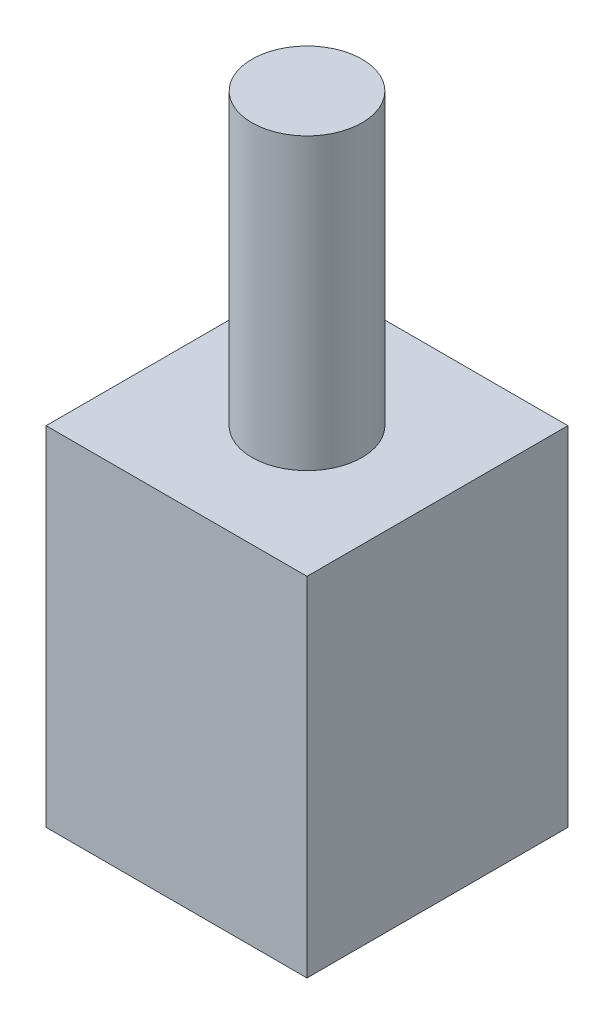
from build123d import *

# Parameters (mm, degrees)
SKETCH_1_W      = 9
SKETCH_1_H      = 9
EXTRUDE_1_DEPTH = 12
SKETCH_2_R      = 1.9
EXTRUDE_2_DEPTH = 10


with BuildPart() as part:
    # 草图1 → 凸台-拉伸1 (new body)
    with BuildSketch(Plane(origin=(0, 0, 0), x_dir=(1, 0, 0), z_dir=(0, 1, 0))):
        with Locations((0.678082192, -0.369863014)):
            Rectangle(SKETCH_1_W, SKETCH_1_H)
    extrude(amount=EXTRUDE_1_DEPTH)

    # 草图2 → 凸台-拉伸2 (add)
    with BuildSketch(Plane(origin=(0, 12, 0), x_dir=(1, 0, 0), z_dir=(0, 1, 0))):
        with Locations(Location((0.678082192, -0.369863014, 0), (0, 0, 270))):
            Circle(SKETCH_2_R)
    extrude(amount=EXTRUDE_2_DEPTH)


solid = part.part
